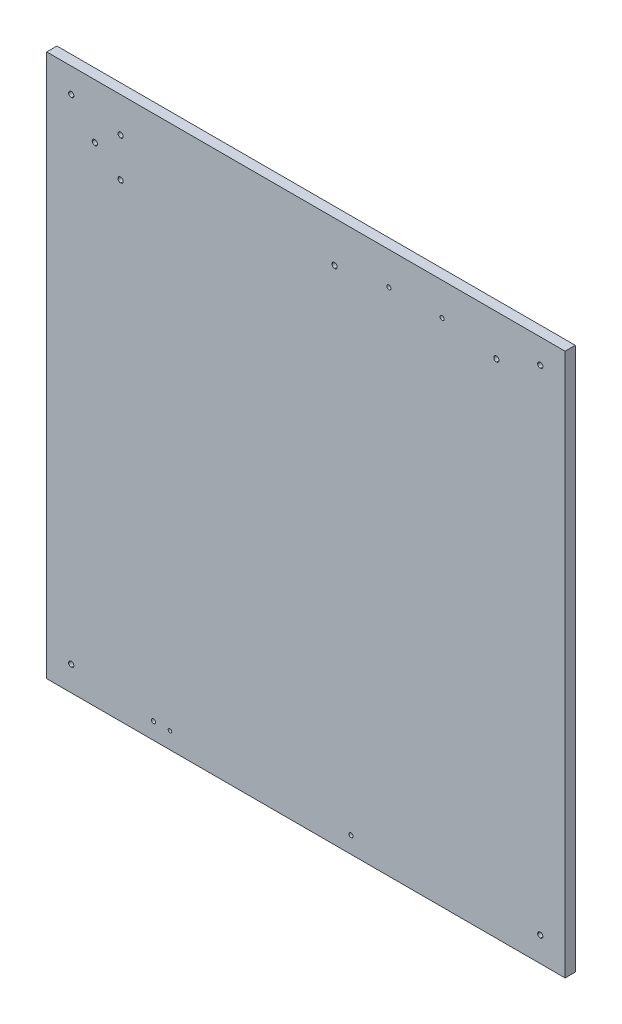
from build123d import *

# Parameters (mm, degrees)
MODEL_W             = 80.01
MODEL_H             = 83.777667
BOSS_EXTRUDE1_DEPTH = 1.575
MODEL_6_R           = 0.318204791
CUT_EXTRUDE4_DEPTH  = 10
MODEL_8_R           = 0.318204729
CUT_EXTRUDE5_DEPTH  = 239.326409502
MODEL_9_R           = 0.27597939
CUT_EXTRUDE6_DEPTH  = 239.326409502
MODEL_10_R          = 0.3182048
CUT_EXTRUDE7_DEPTH  = 239.326409502
MODEL_12_R          = 0.3182048
CUT_EXTRUDE10_DEPTH = 239.326409502


with BuildPart() as part:
    # Model → Boss-Extrude1 (new body)
    with BuildSketch(Plane.XY):
        with Locations((104.944333, 147.2848635)):
            Rectangle(MODEL_W, MODEL_H)
        with BuildLine():
            add(Edge.make_bspline(
                [(76.750333, 177.743697), (76.750333, 177.997697), (76.581, 178.16703), (76.369333, 178.16703)],
                knots=[0, 0, 0, 0, 1, 1, 1, 1], degree=3))
            add(Edge.make_bspline(
                [(76.369333, 178.16703), (76.115333, 178.16703), (75.946, 177.997697), (75.946, 177.743697)],
                knots=[0, 0, 0, 0, 1, 1, 1, 1], degree=3))
            add(Edge.make_bspline(
                [(75.946, 177.743697), (75.946, 177.53203), (76.115333, 177.362697), (76.369333, 177.362697)],
                knots=[0, 0, 0, 0, 1, 1, 1, 1], degree=3))
            add(Edge.make_bspline(
                [(76.369333, 177.362697), (76.581, 177.362697), (76.750333, 177.53203), (76.750333, 177.743697)],
                knots=[0, 0, 0, 0, 1, 1, 1, 1], degree=3))
        make_face(mode=Mode.SUBTRACT)
        with BuildLine():
            add(Edge.make_bspline(
                [(76.750333, 183.75503), (76.750333, 184.00903), (76.581, 184.178363), (76.369333, 184.178363)],
                knots=[0, 0, 0, 0, 1, 1, 1, 1], degree=3))
            add(Edge.make_bspline(
                [(76.369333, 184.178363), (76.115333, 184.178363), (75.946, 184.00903), (75.946, 183.75503)],
                knots=[0, 0, 0, 0, 1, 1, 1, 1], degree=3))
            add(Edge.make_bspline(
                [(75.946, 183.75503), (75.946, 183.543363), (76.115333, 183.37403), (76.369333, 183.37403)],
                knots=[0, 0, 0, 0, 1, 1, 1, 1], degree=3))
            add(Edge.make_bspline(
                [(76.369333, 183.37403), (76.581, 183.37403), (76.750333, 183.543363), (76.750333, 183.75503)],
                knots=[0, 0, 0, 0, 1, 1, 1, 1], degree=3))
        make_face(mode=Mode.SUBTRACT)
        with BuildLine():
            add(Edge.make_bspline(
                [(72.771, 180.749363), (72.771, 181.003363), (72.601667, 181.172697), (72.39, 181.172697)],
                knots=[0, 0, 0, 0, 1, 1, 1, 1], degree=3))
            add(Edge.make_bspline(
                [(72.39, 181.172697), (72.136, 181.172697), (71.966667, 181.003363), (71.966667, 180.749363)],
                knots=[0, 0, 0, 0, 1, 1, 1, 1], degree=3))
            add(Edge.make_bspline(
                [(71.966667, 180.749363), (71.966667, 180.537697), (72.136, 180.368363), (72.39, 180.368363)],
                knots=[0, 0, 0, 0, 1, 1, 1, 1], degree=3))
            add(Edge.make_bspline(
                [(72.39, 180.368363), (72.601667, 180.368363), (72.771, 180.537697), (72.771, 180.749363)],
                knots=[0, 0, 0, 0, 1, 1, 1, 1], degree=3))
        make_face(mode=Mode.SUBTRACT)
        with BuildLine():
            add(Edge.make_bspline(
                [(109.770333, 182.823697), (109.770333, 183.077697), (109.601, 183.24703), (109.389333, 183.24703)],
                knots=[0, 0, 0, 0, 1, 1, 1, 1], degree=3))
            add(Edge.make_bspline(
                [(109.389333, 183.24703), (109.135333, 183.24703), (108.966, 183.077697), (108.966, 182.823697)],
                knots=[0, 0, 0, 0, 1, 1, 1, 1], degree=3))
            add(Edge.make_bspline(
                [(108.966, 182.823697), (108.966, 182.61203), (109.135333, 182.442697), (109.389333, 182.442697)],
                knots=[0, 0, 0, 0, 1, 1, 1, 1], degree=3))
            add(Edge.make_bspline(
                [(109.389333, 182.442697), (109.601, 182.442697), (109.770333, 182.61203), (109.770333, 182.823697)],
                knots=[0, 0, 0, 0, 1, 1, 1, 1], degree=3))
        make_face(mode=Mode.SUBTRACT)
        with BuildLine():
            add(Edge.make_bspline(
                [(134.747, 182.823697), (134.747, 183.077697), (134.577667, 183.24703), (134.366, 183.24703)],
                knots=[0, 0, 0, 0, 1, 1, 1, 1], degree=3))
            add(Edge.make_bspline(
                [(134.366, 183.24703), (134.112, 183.24703), (133.942667, 183.077697), (133.942667, 182.823697)],
                knots=[0, 0, 0, 0, 1, 1, 1, 1], degree=3))
            add(Edge.make_bspline(
                [(133.942667, 182.823697), (133.942667, 182.61203), (134.112, 182.442697), (134.366, 182.442697)],
                knots=[0, 0, 0, 0, 1, 1, 1, 1], degree=3))
            add(Edge.make_bspline(
                [(134.366, 182.442697), (134.577667, 182.442697), (134.747, 182.61203), (134.747, 182.823697)],
                knots=[0, 0, 0, 0, 1, 1, 1, 1], degree=3))
        make_face(mode=Mode.SUBTRACT)
        with BuildLine():
            add(Edge.make_bspline(
                [(141.520333, 109.20603), (141.520333, 109.46003), (141.351, 109.629363), (141.139333, 109.629363)],
                knots=[0, 0, 0, 0, 1, 1, 1, 1], degree=3))
            add(Edge.make_bspline(
                [(141.139333, 109.629363), (140.885333, 109.629363), (140.716, 109.46003), (140.716, 109.20603)],
                knots=[0, 0, 0, 0, 1, 1, 1, 1], degree=3))
            add(Edge.make_bspline(
                [(140.716, 109.20603), (140.716, 108.994363), (140.885333, 108.82503), (141.139333, 108.82503)],
                knots=[0, 0, 0, 0, 1, 1, 1, 1], degree=3))
            add(Edge.make_bspline(
                [(141.139333, 108.82503), (141.351, 108.82503), (141.520333, 108.994363), (141.520333, 109.20603)],
                knots=[0, 0, 0, 0, 1, 1, 1, 1], degree=3))
        make_face(mode=Mode.SUBTRACT)
        with BuildLine():
            add(Edge.make_bspline(
                [(141.520333, 185.363697), (141.520333, 185.617697), (141.351, 185.78703), (141.139333, 185.78703)],
                knots=[0, 0, 0, 0, 1, 1, 1, 1], degree=3))
            add(Edge.make_bspline(
                [(141.139333, 185.78703), (140.885333, 185.78703), (140.716, 185.617697), (140.716, 185.363697)],
                knots=[0, 0, 0, 0, 1, 1, 1, 1], degree=3))
            add(Edge.make_bspline(
                [(140.716, 185.363697), (140.716, 185.15203), (140.885333, 184.982697), (141.139333, 184.982697)],
                knots=[0, 0, 0, 0, 1, 1, 1, 1], degree=3))
            add(Edge.make_bspline(
                [(141.139333, 184.982697), (141.351, 184.982697), (141.520333, 185.15203), (141.520333, 185.363697)],
                knots=[0, 0, 0, 0, 1, 1, 1, 1], degree=3))
        make_face(mode=Mode.SUBTRACT)
        with BuildLine():
            add(Edge.make_bspline(
                [(69.130333, 185.363697), (69.130333, 185.617697), (68.961, 185.78703), (68.749333, 185.78703)],
                knots=[0, 0, 0, 0, 1, 1, 1, 1], degree=3))
            add(Edge.make_bspline(
                [(68.749333, 185.78703), (68.495333, 185.78703), (68.326, 185.617697), (68.326, 185.363697)],
                knots=[0, 0, 0, 0, 1, 1, 1, 1], degree=3))
            add(Edge.make_bspline(
                [(68.326, 185.363697), (68.326, 185.15203), (68.495333, 184.982697), (68.749333, 184.982697)],
                knots=[0, 0, 0, 0, 1, 1, 1, 1], degree=3))
            add(Edge.make_bspline(
                [(68.749333, 184.982697), (68.961, 184.982697), (69.130333, 185.15203), (69.130333, 185.363697)],
                knots=[0, 0, 0, 0, 1, 1, 1, 1], degree=3))
        make_face(mode=Mode.SUBTRACT)
        with BuildLine():
            add(Edge.make_bspline(
                [(69.130333, 109.20603), (69.130333, 109.46003), (68.961, 109.629363), (68.749333, 109.629363)],
                knots=[0, 0, 0, 0, 1, 1, 1, 1], degree=3))
            add(Edge.make_bspline(
                [(68.749333, 109.629363), (68.495333, 109.629363), (68.326, 109.46003), (68.326, 109.20603)],
                knots=[0, 0, 0, 0, 1, 1, 1, 1], degree=3))
            add(Edge.make_bspline(
                [(68.326, 109.20603), (68.326, 108.994363), (68.495333, 108.82503), (68.749333, 108.82503)],
                knots=[0, 0, 0, 0, 1, 1, 1, 1], degree=3))
            add(Edge.make_bspline(
                [(68.749333, 108.82503), (68.961, 108.82503), (69.130333, 108.994363), (69.130333, 109.20603)],
                knots=[0, 0, 0, 0, 1, 1, 1, 1], degree=3))
        make_face(mode=Mode.SUBTRACT)
    extrude(amount=-BOSS_EXTRUDE1_DEPTH)

    # Model_6 → Cut-Extrude4 (cut)
    with BuildSketch(Plane.XY):
        with Locations((125.962833062, 184.114863)):
            Circle(MODEL_6_R)
    extrude(amount=-CUT_EXTRUDE4_DEPTH, mode=Mode.SUBTRACT)

    # Model_8 → Cut-Extrude5 (cut, through all)
    with BuildSketch(Plane.XY):
        with Locations((117.750167, 184.114863)):
            Circle(MODEL_8_R)
    extrude(amount=-CUT_EXTRUDE5_DEPTH, mode=Mode.SUBTRACT)

    # Model_9 → Cut-Extrude6 (cut, through all)
    with BuildSketch(Plane.XY):
        with Locations((83.9681665, 107.9571965)):
            Circle(MODEL_9_R)
    extrude(amount=-CUT_EXTRUDE6_DEPTH, mode=Mode.SUBTRACT)

    # Model_10 → Cut-Extrude7 (cut, through all)
    with BuildSketch(Plane.XY):
        with Locations((111.908167, 107.957197071)):
            Circle(MODEL_10_R)
    extrude(amount=-CUT_EXTRUDE7_DEPTH, mode=Mode.SUBTRACT)

    # Model_12 → Cut-Extrude10 (cut, through all)
    with BuildSketch(Plane.XY):
        with Locations((81.428167, 107.957197071)):
            Circle(MODEL_12_R)
    extrude(amount=-CUT_EXTRUDE10_DEPTH, mode=Mode.SUBTRACT)


solid = part.part
